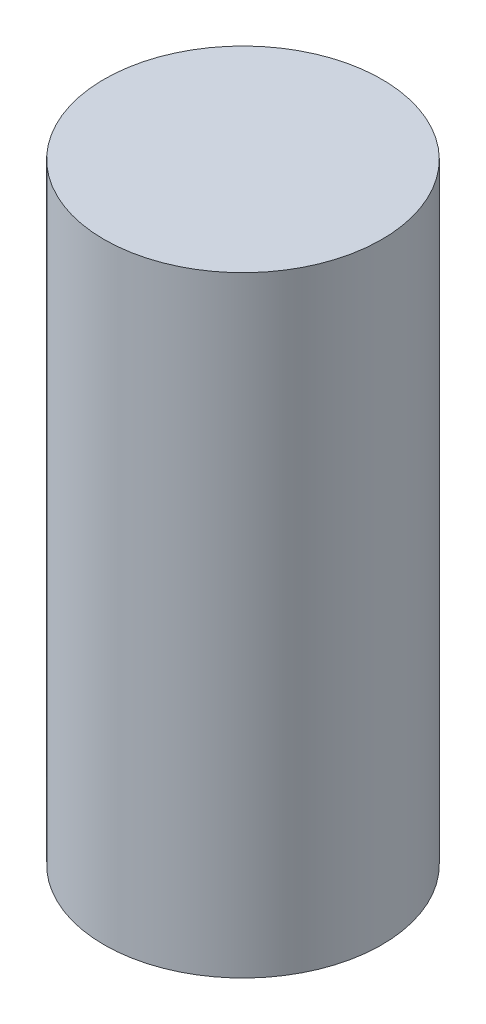
from build123d import *

# Parameters (mm, degrees)
SKETCH_1_R      = 10
EXTRUDE_1_DEPTH = 44


with BuildPart() as part:
    # Эскиз1 → Бобышка-Вытянуть1 (new body)
    with BuildSketch(Plane(origin=(0, 0, 0), x_dir=(1, 0, 0), z_dir=(0, 1, 0))):
        with Locations(Location((0, 0, 0), (0, 0, 270))):
            Circle(SKETCH_1_R)
    extrude(amount=EXTRUDE_1_DEPTH)


solid = part.part
